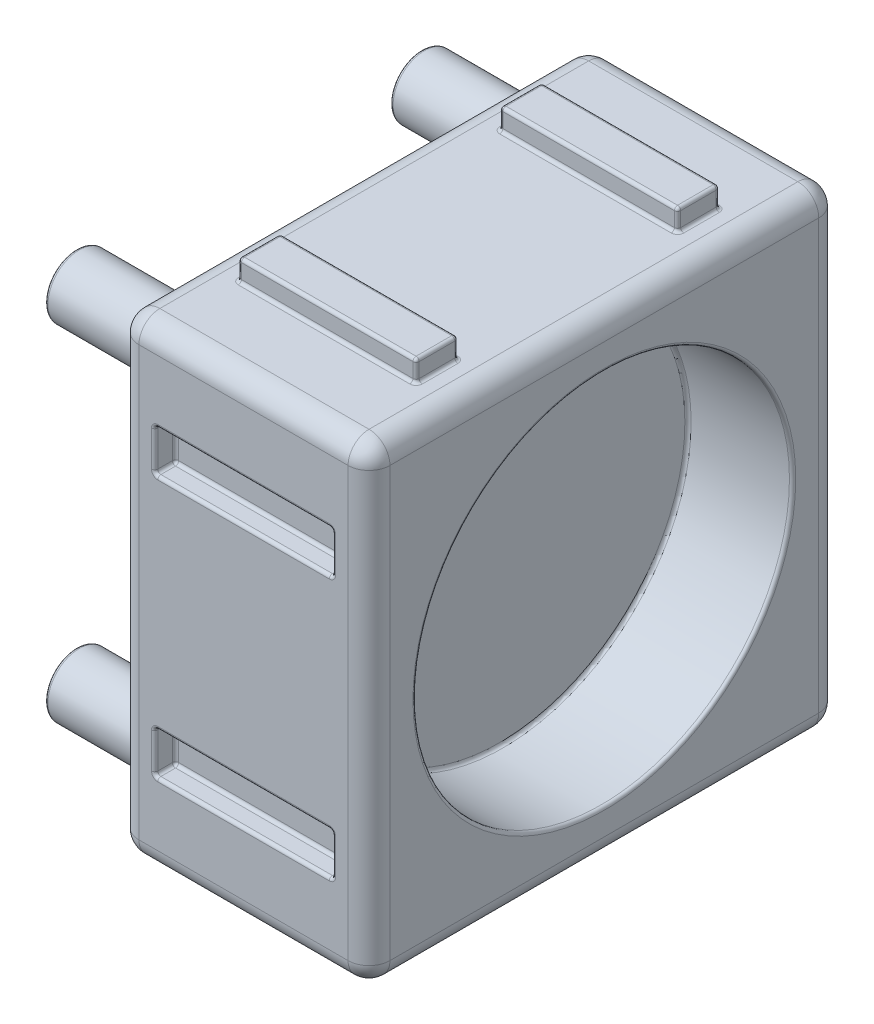
from build123d import *

# Parameters (mm, degrees)
SKETCH1_W           = 12
SKETCH1_H           = 22.5
BOSS_EXTRUDE1_DEPTH = 22.5
SKETCH2_R           = 9
CUT_EXTRUDE1_DEPTH  = 5
SKETCH3_R           = 1.5
BOSS_EXTRUDE2_DEPTH = 5
SKETCH4_R           = 1.5
BOSS_EXTRUDE3_DEPTH = 3
FILLET3_R           = 1
SKETCH5_W           = 8.5
SKETCH5_H           = 2
CUT_EXTRUDE2_DEPTH  = 1
SKETCH6_W           = 8.5
SKETCH6_H           = 2
CUT_EXTRUDE3_DEPTH  = 1
SKETCH7_W           = 8.5
SKETCH7_H           = 2
BOSS_EXTRUDE4_DEPTH = 1
SKETCH8_W           = 8.5
SKETCH8_H           = 2
BOSS_EXTRUDE5_DEPTH = 1
FILLET4_R           = 0.15
FILLET5_R           = 0.15
FILLET6_R           = 0.15


with BuildPart() as part:
    # Sketch1 → Boss-Extrude1 (new body)
    with BuildSketch(Plane(origin=(0, 0, 0), x_dir=(1, 0, 0), z_dir=(0, 1, 0))):
        Rectangle(SKETCH1_W, SKETCH1_H)
    extrude(amount=BOSS_EXTRUDE1_DEPTH)

    # Sketch2 → Cut-Extrude1 (cut)
    with BuildSketch(Plane(origin=(6, 0, 0), x_dir=(0, 0, -1), z_dir=(1, 0, 0))):
        with Locations((0, 11.25)):
            Circle(SKETCH2_R)
    extrude(amount=-CUT_EXTRUDE1_DEPTH, mode=Mode.SUBTRACT)

    # Sketch3 → Boss-Extrude2 (add)
    with BuildSketch(Plane.ZY.offset(6)):
        with Locations(Location((8.25, 19.5, 0), (0, 0, 180))):
            Circle(SKETCH3_R)
        with Locations(Location((8.25, 3, 0), (0, 0, 180))):
            Circle(SKETCH3_R)
        with Locations(Location((-8.25, 19.5, 0), (0, 0, 180))):
            Circle(SKETCH3_R)
        with Locations(Location((-8.25, 3, 0), (0, 0, 180))):
            Circle(SKETCH3_R)
    extrude(amount=BOSS_EXTRUDE2_DEPTH)

    # Sketch4 → Boss-Extrude3 (add)
    with BuildSketch(Plane.ZY.offset(6)):
        with Locations(Location((0, 11.25, 0), (0, 0, 180))):
            Circle(SKETCH4_R)
    extrude(amount=BOSS_EXTRUDE3_DEPTH)

    # Fillet3
    fillet3_edges = [part.edges().sort_by_distance(p)[0] for p in [
        (-6, 22.5, 0),
        (0, 22.5, 11.25),
        (6, 22.5, 0),
        (0, 0, 11.25),
        (-6, 0, 0),
        (0, 0, -11.25),
        (6, 0, 0),
        (0, 22.5, -11.25),
        (6, 11.25, 11.25),
        (-6, 11.25, 11.25),
        (-6, 11.25, -11.25),
        (6, 11.25, -11.25),
    ]]
    fillet(fillet3_edges, radius=FILLET3_R)

    # Sketch5 → Cut-Extrude2 (cut)
    with BuildSketch(Plane(origin=(0, 0, 0), x_dir=(-1, 0, 0), z_dir=(0, -1, 0))):
        with Locations((0, 6.25)):
            Rectangle(SKETCH5_W, SKETCH5_H)
        with Locations((0, -6.25)):
            Rectangle(SKETCH5_W, SKETCH5_H)
    extrude(amount=-CUT_EXTRUDE2_DEPTH, mode=Mode.SUBTRACT)

    # Sketch6 → Cut-Extrude3 (cut)
    with BuildSketch(Plane.XY.offset(11.25)):
        with Locations((0, 5)):
            Rectangle(SKETCH6_W, SKETCH6_H)
        with Locations((0, 17.5)):
            Rectangle(SKETCH6_W, SKETCH6_H)
    extrude(amount=-CUT_EXTRUDE3_DEPTH, mode=Mode.SUBTRACT)

    # Sketch7 → Boss-Extrude4 (add)
    with BuildSketch(Plane(origin=(0, 22.5, 0), x_dir=(1, 0, 0), z_dir=(0, 1, 0))):
        with Locations((0, -6.25)):
            Rectangle(SKETCH7_W, SKETCH7_H)
        with Locations((0, 6.25)):
            Rectangle(SKETCH7_W, SKETCH7_H)
    extrude(amount=BOSS_EXTRUDE4_DEPTH)

    # Sketch8 → Boss-Extrude5 (add)
    with BuildSketch(Plane(origin=(0, 0, -11.25), x_dir=(-1, 0, 0), z_dir=(0, 0, -1))):
        with Locations((0, 17.5)):
            Rectangle(SKETCH8_W, SKETCH8_H)
        with Locations((0, 5)):
            Rectangle(SKETCH8_W, SKETCH8_H)
    extrude(amount=BOSS_EXTRUDE5_DEPTH)

    # Fillet4
    fillet4_edges = [part.edges().sort_by_distance(p)[0] for p in [
        (-4.25, 5, 10.25),
        (-4.25, 4, 10.75),
        (0, 6, 10.25),
        (-4.25, 6, 10.75),
        (4.25, 5, 10.25),
        (4.25, 6, 10.75),
        (0, 4, 10.25),
        (4.25, 4, 10.75),
        (-4.25, 5, 11.25),
        (0, 4, 11.25),
        (4.25, 5, 11.25),
        (0, 6, 11.25),
        (0, 18.5, 10.25),
        (-4.25, 18.5, 10.75),
        (4.25, 17.5, 10.25),
        (4.25, 18.5, 10.75),
        (0, 16.5, 10.25),
        (4.25, 16.5, 10.75),
        (-4.25, 17.5, 10.25),
        (-4.25, 16.5, 10.75),
        (0, 18.5, 11.25),
        (-4.25, 17.5, 11.25),
        (0, 16.5, 11.25),
        (4.25, 17.5, 11.25),
        (-4.25, 22.5, 6.25),
        (-4.25, 23, 5.25),
        (0, 22.5, 7.25),
        (-4.25, 23, 7.25),
        (4.25, 22.5, 6.25),
        (4.25, 23, 7.25),
        (0, 22.5, 5.25),
        (4.25, 23, 5.25),
        (-4.25, 23.5, 6.25),
        (0, 23.5, 7.25),
        (4.25, 23.5, 6.25),
        (0, 23.5, 5.25),
        (0, 22.5, -7.25),
        (4.25, 23, -7.25),
        (-4.25, 22.5, -6.25),
        (-4.25, 23, -7.25),
        (0, 22.5, -5.25),
        (-4.25, 23, -5.25),
        (4.25, 22.5, -6.25),
        (4.25, 23, -5.25),
        (0, 23.5, -7.25),
        (-4.25, 23.5, -6.25),
        (0, 23.5, -5.25),
        (4.25, 23.5, -6.25),
        (-4.25, 17.5, -11.25),
        (-4.25, 16.5, -11.75),
        (0, 18.5, -11.25),
        (-4.25, 18.5, -11.75),
        (4.25, 17.5, -11.25),
        (4.25, 18.5, -11.75),
        (0, 16.5, -11.25),
        (4.25, 16.5, -11.75),
        (-4.25, 17.5, -12.25),
        (0, 18.5, -12.25),
        (4.25, 17.5, -12.25),
        (0, 16.5, -12.25),
        (0, 4, -11.25),
        (4.25, 4, -11.75),
        (-4.25, 5, -11.25),
        (-4.25, 4, -11.75),
        (0, 6, -11.25),
        (-4.25, 6, -11.75),
        (4.25, 5, -11.25),
        (4.25, 6, -11.75),
        (0, 4, -12.25),
        (-4.25, 5, -12.25),
        (0, 6, -12.25),
        (4.25, 5, -12.25),
        (-4.25, 1, -6.25),
        (-4.25, 0.5, -7.25),
        (0, 1, -5.25),
        (-4.25, 0.5, -5.25),
        (4.25, 1, -6.25),
        (4.25, 0.5, -5.25),
        (0, 1, -7.25),
        (4.25, 0.5, -7.25),
        (-4.25, 0, -6.25),
        (0, 0, -7.25),
        (4.25, 0, -6.25),
        (0, 0, -5.25),
        (0, 1, 7.25),
        (-4.25, 0.5, 7.25),
        (4.25, 1, 6.25),
        (4.25, 0.5, 7.25),
        (0, 1, 5.25),
        (4.25, 0.5, 5.25),
        (-4.25, 1, 6.25),
        (-4.25, 0.5, 5.25),
        (0, 0, 7.25),
        (-4.25, 0, 6.25),
        (0, 0, 5.25),
        (4.25, 0, 6.25),
    ]]
    fillet(fillet4_edges, radius=FILLET4_R)

    # Fillet5
    fillet5_edges = [part.edges().sort_by_distance(p)[0] for p in [
        (-6, 19.5, 9.75),
        (-11, 19.5, 9.75),
        (-6, 3, 9.75),
        (-11, 3, 9.75),
        (-6, 19.5, -6.75),
        (-11, 19.5, -6.75),
        (-6, 3, -6.75),
        (-11, 3, -6.75),
        (-6, 11.25, 1.5),
        (-9, 11.25, 1.5),
    ]]
    fillet(fillet5_edges, radius=FILLET5_R)

    # Fillet6
    fillet6_edges = [part.edges().sort_by_distance(p)[0] for p in [
        (1, 11.25, 9),
        (6, 11.25, 9),
    ]]
    fillet(fillet6_edges, radius=FILLET6_R)


solid = part.part
